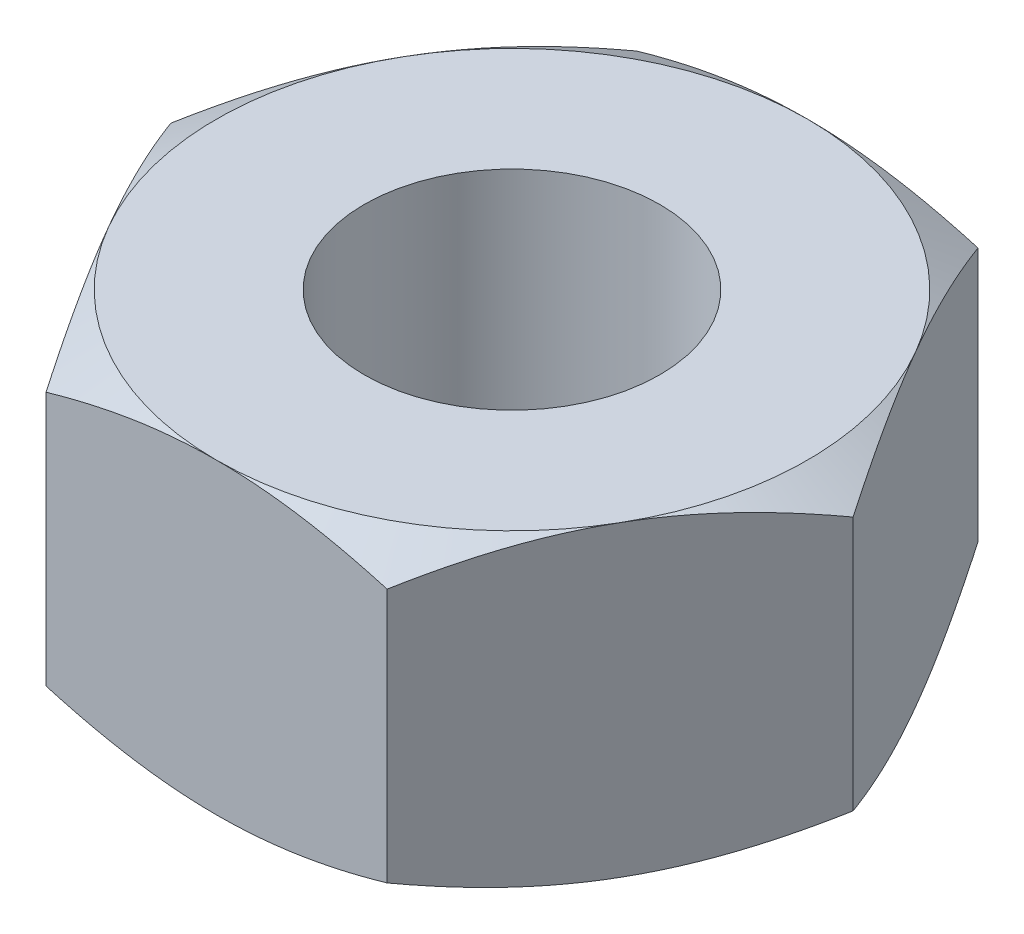
from build123d import *

# Parameters (mm, degrees)
SKETCH1_R           = 2.5
BOSS_EXTRUDE1_DEPTH = 2.6


with BuildPart() as part:
    # Sketch1 → Boss-Extrude1 (new, symmetric)
    with BuildSketch(Plane(origin=(0, 0, 0), x_dir=(1, 0, 0), z_dir=(0, 1, 0))):
        Polygon((5.773502692, 0), (2.886751346, 5), (-2.886751346, 5), (-5.773502692, 0), (-2.886751346, -5), (2.886751346, -5), align=None)
        with Locations(Location((0, 0, 0), (0, 0, 270))):
            Circle(SKETCH1_R, mode=Mode.SUBTRACT)
    extrude(amount=BOSS_EXTRUDE1_DEPTH, both=True)

    # Sketch3 → Cut-Revolve2 (revolve, cut)
    with BuildSketch(Plane(origin=(0, 0, 0), x_dir=(0, 0, -1), z_dir=(1, 0, 0))):
        Polygon((4.133974596, 3.1), (5.866025404, 2.1), (6.366025404, 2.966025404), (4.633974596, 3.966025404), align=None)
    cut_revolve2 = revolve(axis=Axis((0, -2.6, 0), (0, 1, 0)), mode=Mode.SUBTRACT)

    # Mirror1: Cut-Revolve2 across plane
    add(cut_revolve2.mirror(Plane.ZX), mode=Mode.SUBTRACT)


solid = part.part
